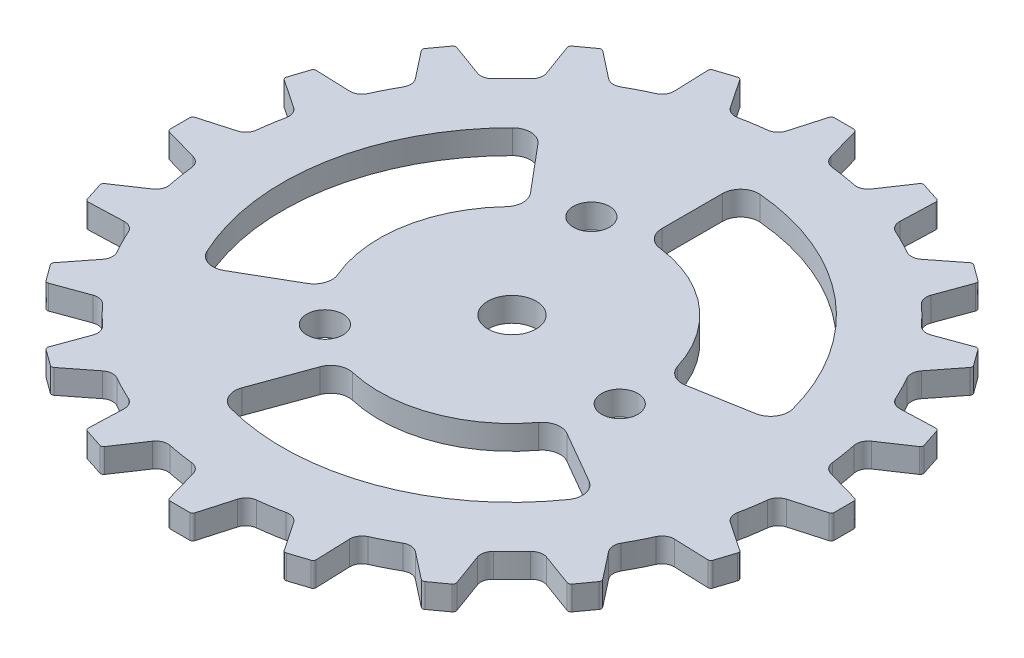
from build123d import *

# Parameters (mm, degrees)
SKETCH_1_R      = 2
SKETCH_1_R_2    = 1.5
EXTRUDE_1_DEPTH = 2
FILLET_1_R      = 1.5


with BuildPart() as part:
    # 草图1 → 凸台-拉伸1 (new body)
    with BuildSketch(Plane(origin=(0, 0, 0), x_dir=(1, 0, 0), z_dir=(0, 1, 0))):
        with BuildLine():
            Line((-0.811424647, 27.5), (0.811424647, 27.5))
            ThreePointArc((0.811424647, 27.5), (0.961973525, 27.449587162), (1.051805634, 27.318680282))
            Line((1.051805634, 27.318680282), (1.837693654, 24.56807221))
            ThreePointArc((1.837693654, 24.56807221), (2.153204064, 24.079467386), (2.687248898, 23.849081604))
            ThreePointArc((2.687248898, 23.849081604), (3.754427161, 23.704520174), (4.814045941, 23.512230045))
            ThreePointArc((4.814045941, 23.512230045), (5.393145882, 23.566311014), (5.844201307, 23.933503738))
            Line((5.844201307, 23.933503738), (7.441609869, 26.306634714))
            ThreePointArc((7.441609869, 26.306634714), (7.567497732, 26.403374907), (7.726256647, 26.404798204))
            Line((7.726256647, 26.404798204), (9.269678043, 25.903310193))
            ThreePointArc((9.269678043, 25.903310193), (9.397280111, 25.808842573), (9.442263073, 25.656583083))
            Line((9.442263073, 25.656583083), (9.339702357, 22.797746598))
            ThreePointArc((9.339702357, 22.797746598), (9.488783394, 22.235557718), (9.925497091, 21.85141889))
            ThreePointArc((9.925497091, 21.85141889), (10.895771994, 21.384156581), (11.844108421, 20.873837589))
            ThreePointArc((11.844108421, 20.873837589), (12.411577132, 20.746319925), (12.954025125, 20.956157165))
            Line((12.954025125, 20.956157165), (15.206588749, 22.719512452))
            ThreePointArc((15.206588749, 22.719512452), (15.356209585, 22.772616354), (15.507638109, 22.724910786))
            Line((15.507638109, 22.724910786), (16.820550767, 21.771023905))
            ThreePointArc((16.820550767, 21.771023905), (16.912715445, 21.641748652), (16.908446014, 21.483040772))
            Line((16.908446014, 21.483040772), (15.927475919, 18.795818708))
            ThreePointArc((15.927475919, 18.795818708), (15.895534493, 18.215076736), (16.192168474, 17.714787047))
            ThreePointArc((16.192168474, 17.714787047), (16.970562748, 16.970562748), (17.714787047, 16.192168474))
            ThreePointArc((17.714787047, 16.192168474), (18.215076736, 15.895534493), (18.795818708, 15.927475919))
            Line((18.795818708, 15.927475919), (21.483040772, 16.908446014))
            ThreePointArc((21.483040772, 16.908446014), (21.641748652, 16.912715445), (21.771023905, 16.820550767))
            Line((21.771023905, 16.820550767), (22.724910786, 15.507638109))
            ThreePointArc((22.724910786, 15.507638109), (22.772616354, 15.356209585), (22.719512452, 15.206588749))
            Line((22.719512452, 15.206588749), (20.956157165, 12.954025125))
            ThreePointArc((20.956157165, 12.954025125), (20.746319925, 12.411577132), (20.873837589, 11.844108421))
            ThreePointArc((20.873837589, 11.844108421), (21.384156581, 10.895771994), (21.85141889, 9.925497091))
            ThreePointArc((21.85141889, 9.925497091), (22.235557718, 9.488783394), (22.797746598, 9.339702357))
            Line((22.797746598, 9.339702357), (25.656583083, 9.442263073))
            ThreePointArc((25.656583083, 9.442263073), (25.808842573, 9.397280111), (25.903310193, 9.269678043))
            Line((25.903310193, 9.269678043), (26.404798204, 7.726256647))
            ThreePointArc((26.404798204, 7.726256647), (26.403374907, 7.567497732), (26.306634714, 7.441609869))
            Line((26.306634714, 7.441609869), (23.933503738, 5.844201307))
            ThreePointArc((23.933503738, 5.844201307), (23.566311014, 5.393145882), (23.512230045, 4.814045941))
            ThreePointArc((23.512230045, 4.814045941), (23.704520174, 3.754427161), (23.849081604, 2.687248898))
            ThreePointArc((23.849081604, 2.687248898), (24.079467386, 2.153204064), (24.56807221, 1.837693654))
            Line((24.56807221, 1.837693654), (27.318680282, 1.051805634))
            ThreePointArc((27.318680282, 1.051805634), (27.449587162, 0.961973525), (27.5, 0.811424647))
            Line((27.5, 0.811424647), (27.5, -0.811424647))
            ThreePointArc((27.5, -0.811424647), (27.449587162, -0.961973525), (27.318680282, -1.051805634))
            Line((27.318680282, -1.051805634), (24.56807221, -1.837693654))
            ThreePointArc((24.56807221, -1.837693654), (24.079467386, -2.153204064), (23.849081604, -2.687248898))
            ThreePointArc((23.849081604, -2.687248898), (23.704520174, -3.754427161), (23.512230045, -4.814045941))
            ThreePointArc((23.512230045, -4.814045941), (23.566311014, -5.393145882), (23.933503738, -5.844201307))
            Line((23.933503738, -5.844201307), (26.306634714, -7.441609869))
            ThreePointArc((26.306634714, -7.441609869), (26.403374907, -7.567497732), (26.404798204, -7.726256647))
            Line((26.404798204, -7.726256647), (25.903310193, -9.269678043))
            ThreePointArc((25.903310193, -9.269678043), (25.808842573, -9.397280111), (25.656583083, -9.442263073))
            Line((25.656583083, -9.442263073), (22.797746598, -9.339702357))
            ThreePointArc((22.797746598, -9.339702357), (22.235557718, -9.488783394), (21.85141889, -9.925497091))
            ThreePointArc((21.85141889, -9.925497091), (21.384156581, -10.895771994), (20.873837589, -11.844108421))
            ThreePointArc((20.873837589, -11.844108421), (20.746319925, -12.411577132), (20.956157165, -12.954025125))
            Line((20.956157165, -12.954025125), (22.719512452, -15.206588749))
            ThreePointArc((22.719512452, -15.206588749), (22.772616354, -15.356209585), (22.724910786, -15.507638109))
            Line((22.724910786, -15.507638109), (21.771023905, -16.820550767))
            ThreePointArc((21.771023905, -16.820550767), (21.641748652, -16.912715445), (21.483040772, -16.908446014))
            Line((21.483040772, -16.908446014), (18.795818708, -15.927475919))
            ThreePointArc((18.795818708, -15.927475919), (18.215076736, -15.895534493), (17.714787047, -16.192168474))
            ThreePointArc((17.714787047, -16.192168474), (16.970562748, -16.970562748), (16.192168474, -17.714787047))
            ThreePointArc((16.192168474, -17.714787047), (15.895534493, -18.215076736), (15.927475919, -18.795818708))
            Line((15.927475919, -18.795818708), (16.908446014, -21.483040772))
            ThreePointArc((16.908446014, -21.483040772), (16.912715445, -21.641748652), (16.820550767, -21.771023905))
            Line((16.820550767, -21.771023905), (15.507638109, -22.724910786))
            ThreePointArc((15.507638109, -22.724910786), (15.356209585, -22.772616354), (15.206588749, -22.719512452))
            Line((15.206588749, -22.719512452), (12.954025125, -20.956157165))
            ThreePointArc((12.954025125, -20.956157165), (12.411577132, -20.746319925), (11.844108421, -20.873837589))
            ThreePointArc((11.844108421, -20.873837589), (10.895771994, -21.384156581), (9.925497091, -21.85141889))
            ThreePointArc((9.925497091, -21.85141889), (9.488783394, -22.235557718), (9.339702357, -22.797746598))
            Line((9.339702357, -22.797746598), (9.442263073, -25.656583083))
            ThreePointArc((9.442263073, -25.656583083), (9.397280111, -25.808842573), (9.269678043, -25.903310193))
            Line((9.269678043, -25.903310193), (7.726256647, -26.404798204))
            ThreePointArc((7.726256647, -26.404798204), (7.567497732, -26.403374907), (7.441609869, -26.306634714))
            Line((7.441609869, -26.306634714), (5.844201307, -23.933503738))
            ThreePointArc((5.844201307, -23.933503738), (5.393145882, -23.566311014), (4.814045941, -23.512230045))
            ThreePointArc((4.814045941, -23.512230045), (3.754427161, -23.704520174), (2.687248898, -23.849081604))
            ThreePointArc((2.687248898, -23.849081604), (2.153204064, -24.079467386), (1.837693654, -24.56807221))
            Line((1.837693654, -24.56807221), (1.051805634, -27.318680282))
            ThreePointArc((1.051805634, -27.318680282), (0.961973525, -27.449587162), (0.811424647, -27.5))
            Line((0.811424647, -27.5), (-0.811424647, -27.5))
            ThreePointArc((-0.811424647, -27.5), (-0.961973525, -27.449587162), (-1.051805634, -27.318680282))
            Line((-1.051805634, -27.318680282), (-1.837693654, -24.56807221))
            ThreePointArc((-1.837693654, -24.56807221), (-2.153204064, -24.079467386), (-2.687248898, -23.849081604))
            ThreePointArc((-2.687248898, -23.849081604), (-3.754427161, -23.704520174), (-4.814045941, -23.512230045))
            ThreePointArc((-4.814045941, -23.512230045), (-5.393145882, -23.566311014), (-5.844201307, -23.933503738))
            Line((-5.844201307, -23.933503738), (-7.441609869, -26.306634714))
            ThreePointArc((-7.441609869, -26.306634714), (-7.567497732, -26.403374907), (-7.726256647, -26.404798204))
            Line((-7.726256647, -26.404798204), (-9.269678043, -25.903310193))
            ThreePointArc((-9.269678043, -25.903310193), (-9.397280111, -25.808842573), (-9.442263073, -25.656583083))
            Line((-9.442263073, -25.656583083), (-9.339702357, -22.797746598))
            ThreePointArc((-9.339702357, -22.797746598), (-9.488783394, -22.235557718), (-9.925497091, -21.85141889))
            ThreePointArc((-9.925497091, -21.85141889), (-10.895771994, -21.384156581), (-11.844108421, -20.873837589))
            ThreePointArc((-11.844108421, -20.873837589), (-12.411577132, -20.746319925), (-12.954025125, -20.956157165))
            Line((-12.954025125, -20.956157165), (-15.206588749, -22.719512452))
            ThreePointArc((-15.206588749, -22.719512452), (-15.356209585, -22.772616354), (-15.507638109, -22.724910786))
            Line((-15.507638109, -22.724910786), (-16.820550767, -21.771023905))
            ThreePointArc((-16.820550767, -21.771023905), (-16.912715445, -21.641748652), (-16.908446014, -21.483040772))
            Line((-16.908446014, -21.483040772), (-15.927475919, -18.795818708))
            ThreePointArc((-15.927475919, -18.795818708), (-15.895534493, -18.215076736), (-16.192168474, -17.714787047))
            ThreePointArc((-16.192168474, -17.714787047), (-16.970562748, -16.970562748), (-17.714787047, -16.192168474))
            ThreePointArc((-17.714787047, -16.192168474), (-18.215076736, -15.895534493), (-18.795818708, -15.927475919))
            Line((-18.795818708, -15.927475919), (-21.483040772, -16.908446014))
            ThreePointArc((-21.483040772, -16.908446014), (-21.641748652, -16.912715445), (-21.771023905, -16.820550767))
            Line((-21.771023905, -16.820550767), (-22.724910786, -15.507638109))
            ThreePointArc((-22.724910786, -15.507638109), (-22.772616354, -15.356209585), (-22.719512452, -15.206588749))
            Line((-22.719512452, -15.206588749), (-20.956157165, -12.954025125))
            ThreePointArc((-20.956157165, -12.954025125), (-20.746319925, -12.411577132), (-20.873837589, -11.844108421))
            ThreePointArc((-20.873837589, -11.844108421), (-21.384156581, -10.895771994), (-21.85141889, -9.925497091))
            ThreePointArc((-21.85141889, -9.925497091), (-22.235557718, -9.488783394), (-22.797746598, -9.339702357))
            Line((-22.797746598, -9.339702357), (-25.656583083, -9.442263073))
            ThreePointArc((-25.656583083, -9.442263073), (-25.808842573, -9.397280111), (-25.903310193, -9.269678043))
            Line((-25.903310193, -9.269678043), (-26.404798204, -7.726256647))
            ThreePointArc((-26.404798204, -7.726256647), (-26.403374907, -7.567497732), (-26.306634714, -7.441609869))
            Line((-26.306634714, -7.441609869), (-23.933503738, -5.844201307))
            ThreePointArc((-23.933503738, -5.844201307), (-23.566311014, -5.393145882), (-23.512230045, -4.814045941))
            ThreePointArc((-23.512230045, -4.814045941), (-23.704520174, -3.754427161), (-23.849081604, -2.687248898))
            ThreePointArc((-23.849081604, -2.687248898), (-24.079467386, -2.153204064), (-24.56807221, -1.837693654))
            Line((-24.56807221, -1.837693654), (-27.318680282, -1.051805634))
            ThreePointArc((-27.318680282, -1.051805634), (-27.449587162, -0.961973525), (-27.5, -0.811424647))
            Line((-27.5, -0.811424647), (-27.5, 0.811424647))
            ThreePointArc((-27.5, 0.811424647), (-27.449587162, 0.961973525), (-27.318680282, 1.051805634))
            Line((-27.318680282, 1.051805634), (-24.56807221, 1.837693654))
            ThreePointArc((-24.56807221, 1.837693654), (-24.079467386, 2.153204064), (-23.849081604, 2.687248898))
            ThreePointArc((-23.849081604, 2.687248898), (-23.704520174, 3.754427161), (-23.512230045, 4.814045941))
            ThreePointArc((-23.512230045, 4.814045941), (-23.566311014, 5.393145882), (-23.933503738, 5.844201307))
            Line((-23.933503738, 5.844201307), (-26.306634714, 7.441609869))
            ThreePointArc((-26.306634714, 7.441609869), (-26.403374907, 7.567497732), (-26.404798204, 7.726256647))
            Line((-26.404798204, 7.726256647), (-25.903310193, 9.269678043))
            ThreePointArc((-25.903310193, 9.269678043), (-25.808842573, 9.397280111), (-25.656583083, 9.442263073))
            Line((-25.656583083, 9.442263073), (-22.797746598, 9.339702357))
            ThreePointArc((-22.797746598, 9.339702357), (-22.235557718, 9.488783394), (-21.85141889, 9.925497091))
            ThreePointArc((-21.85141889, 9.925497091), (-21.384156581, 10.895771994), (-20.873837589, 11.844108421))
            ThreePointArc((-20.873837589, 11.844108421), (-20.746319925, 12.411577132), (-20.956157165, 12.954025125))
            Line((-20.956157165, 12.954025125), (-22.719512452, 15.206588749))
            ThreePointArc((-22.719512452, 15.206588749), (-22.772616354, 15.356209585), (-22.724910786, 15.507638109))
            Line((-22.724910786, 15.507638109), (-21.771023905, 16.820550767))
            ThreePointArc((-21.771023905, 16.820550767), (-21.641748652, 16.912715445), (-21.483040772, 16.908446014))
            Line((-21.483040772, 16.908446014), (-18.795818708, 15.927475919))
            ThreePointArc((-18.795818708, 15.927475919), (-18.215076736, 15.895534493), (-17.714787047, 16.192168474))
            ThreePointArc((-17.714787047, 16.192168474), (-16.970562748, 16.970562748), (-16.192168474, 17.714787047))
            ThreePointArc((-16.192168474, 17.714787047), (-15.895534493, 18.215076736), (-15.927475919, 18.795818708))
            Line((-15.927475919, 18.795818708), (-16.908446014, 21.483040772))
            ThreePointArc((-16.908446014, 21.483040772), (-16.912715445, 21.641748652), (-16.820550767, 21.771023905))
            Line((-16.820550767, 21.771023905), (-15.507638109, 22.724910786))
            ThreePointArc((-15.507638109, 22.724910786), (-15.356209585, 22.772616354), (-15.206588749, 22.719512452))
            Line((-15.206588749, 22.719512452), (-12.954025125, 20.956157165))
            ThreePointArc((-12.954025125, 20.956157165), (-12.411577132, 20.746319925), (-11.844108421, 20.873837589))
            ThreePointArc((-11.844108421, 20.873837589), (-10.895771994, 21.384156581), (-9.925497091, 21.85141889))
            ThreePointArc((-9.925497091, 21.85141889), (-9.488783394, 22.235557718), (-9.339702357, 22.797746598))
            Line((-9.339702357, 22.797746598), (-9.442263073, 25.656583083))
            ThreePointArc((-9.442263073, 25.656583083), (-9.397280111, 25.808842573), (-9.269678043, 25.903310193))
            Line((-9.269678043, 25.903310193), (-7.726256647, 26.404798204))
            ThreePointArc((-7.726256647, 26.404798204), (-7.567497732, 26.403374907), (-7.441609869, 26.306634714))
            Line((-7.441609869, 26.306634714), (-5.844201307, 23.933503738))
            ThreePointArc((-5.844201307, 23.933503738), (-5.393145882, 23.566311014), (-4.814045941, 23.512230045))
            ThreePointArc((-4.814045941, 23.512230045), (-3.754427161, 23.704520174), (-2.687248898, 23.849081604))
            ThreePointArc((-2.687248898, 23.849081604), (-2.153204064, 24.079467386), (-1.837693654, 24.56807221))
            Line((-1.837693654, 24.56807221), (-1.051805634, 27.318680282))
            ThreePointArc((-1.051805634, 27.318680282), (-0.961973525, 27.449587162), (-0.811424647, 27.5))
        make_face()
        with Locations(Location((0, 0, 0), (0, 0, 270))):
            Circle(SKETCH_1_R, mode=Mode.SUBTRACT)
        with Locations(Location((-3.762221577, 10.336618829, 0), (0, 0, 270))):
            Circle(SKETCH_1_R_2, mode=Mode.SUBTRACT)
        with Locations(Location((10.832885283, -1.910129954, 0), (0, 0, 270))):
            Circle(SKETCH_1_R_2, mode=Mode.SUBTRACT)
        with Locations(Location((-7.070663707, -8.426488874, 0), (0, 0, 270))):
            Circle(SKETCH_1_R_2, mode=Mode.SUBTRACT)
        with BuildLine():
            Line((0, 19), (0, 11))
            ThreePointArc((0, 11), (7.070663707, 8.426488874), (10.832885283, 1.910129954))
            Line((10.832885283, 1.910129954), (18.711347307, 3.299315376))
            ThreePointArc((18.711347307, 3.299315376), (12.212964584, 14.554844419), (0, 19))
        make_face(mode=Mode.SUBTRACT)
        with BuildLine():
            Line((16.454482672, -9.5), (9.526279442, -5.5))
            ThreePointArc((9.526279442, -5.5), (3.762221577, -10.336618829), (-3.762221577, -10.336618829))
            Line((-3.762221577, -10.336618829), (-6.498382723, -17.854159795))
            ThreePointArc((-6.498382723, -17.854159795), (6.498382723, -17.854159795), (16.454482672, -9.5))
        make_face(mode=Mode.SUBTRACT)
        with BuildLine():
            Line((-16.454482672, -9.5), (-9.526279442, -5.5))
            ThreePointArc((-9.526279442, -5.5), (-10.832885283, 1.910129954), (-7.070663707, 8.426488874))
            Line((-7.070663707, 8.426488874), (-12.212964584, 14.554844419))
            ThreePointArc((-12.212964584, 14.554844419), (-18.711347307, 3.299315376), (-16.454482672, -9.5))
        make_face(mode=Mode.SUBTRACT)
    extrude(amount=EXTRUDE_1_DEPTH)

    # 圆角1
    fillet_1_edges = [part.edges().sort_by_distance(p)[0] for p in [
        (18.711347307, 1, -3.299315376),
        (0, 1, -19),
        (0, 1, -11),
        (10.832885283, 1, -1.910129954),
        (-6.498382723, 1, 17.854159795),
        (16.454482672, 1, 9.5),
        (9.526279442, 1, 5.5),
        (-3.762221577, 1, 10.336618829),
        (-12.212964584, 1, -14.554844419),
        (-16.454482672, 1, 9.5),
        (-9.526279442, 1, 5.5),
        (-7.070663707, 1, -8.426488874),
    ]]
    fillet(fillet_1_edges, radius=FILLET_1_R)


solid = part.part
